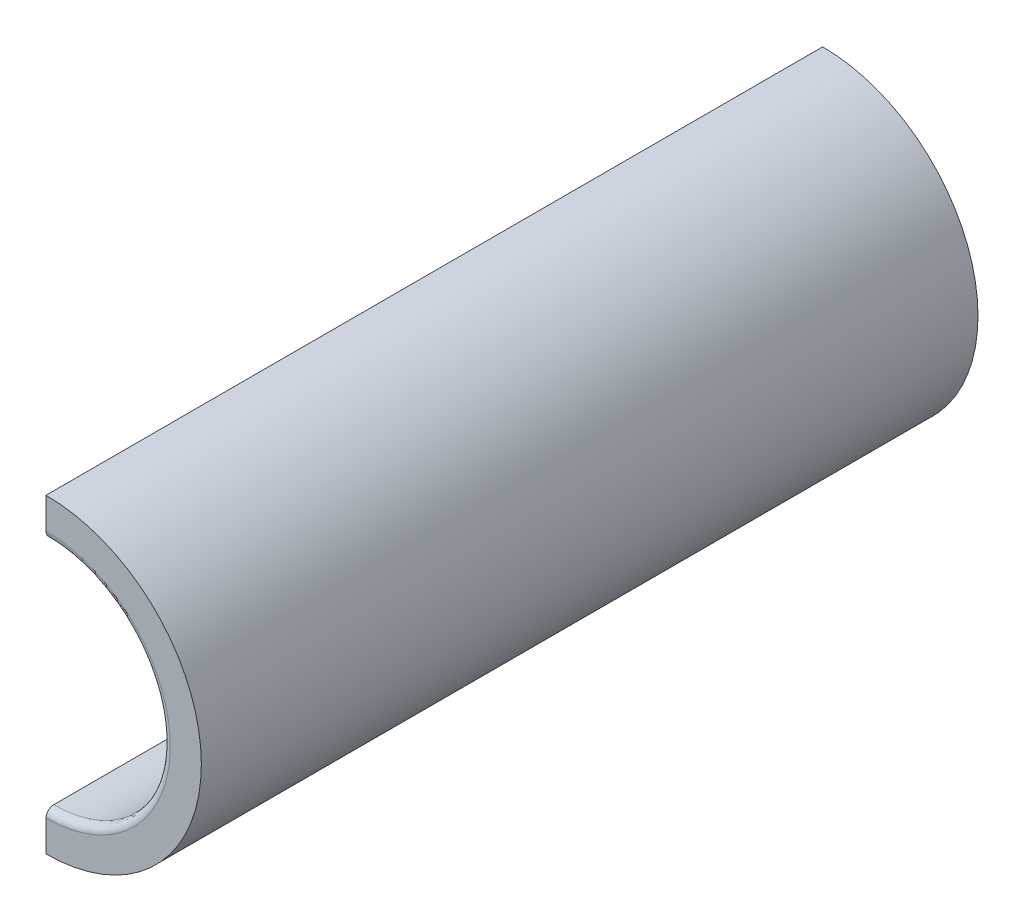
from build123d import *

# Parameters (mm, degrees)
AUFSATZ_LINEAR_AUSTRAGEN1_DEPTH = 100
VERRUNDUNG1_R                   = 2


with BuildPart() as part:
    # Skizze1 → Aufsatz-Linear austragen1 (new, symmetric)
    with BuildSketch(Plane.XY):
        with BuildLine():
            Line((0, 40), (0, 30))
            ThreePointArc((0, 30), (30, 0), (0, -30))
            Line((0, -30), (0, -40))
            ThreePointArc((0, -40), (40, 0), (0, 40))
        make_face()
    extrude(amount=AUFSATZ_LINEAR_AUSTRAGEN1_DEPTH, both=True)

    # Verrundung1
    verrundung1_edges = [part.edges().sort_by_distance(p)[0] for p in [
        (30, 0, 100),
        (30, 0, -100),
    ]]
    fillet(verrundung1_edges, radius=VERRUNDUNG1_R)


solid = part.part
